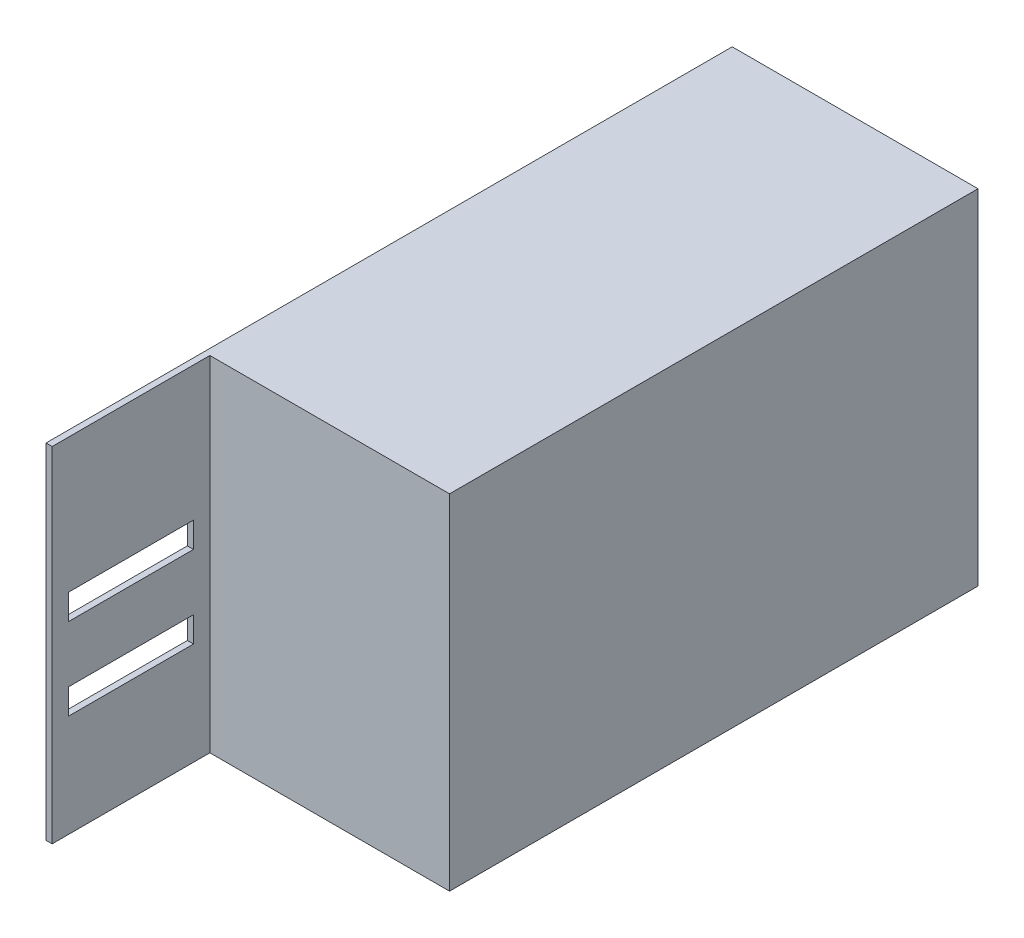
from build123d import *

# Parameters (mm, degrees)
SKETCH1_W           = 84
SKETCH1_H           = 129
BOSS_EXTRUDE1_DEPTH = 60
SHELL1_T            = -1.5
CUT_EXTRUDE1_DEPTH  = 127.5
SKETCH3_W           = 40
SKETCH3_H           = 84
BOSS_EXTRUDE2_DEPTH = 1.5
SKETCH4_W           = 30.5
SKETCH4_H           = 6.2
CUT_EXTRUDE2_DEPTH  = 165.679233664


with BuildPart() as part:
    # Sketch1 → Boss-Extrude1 (new body)
    with BuildSketch(Plane.YZ):
        with Locations((42, -64.5)):
            Rectangle(SKETCH1_W, SKETCH1_H)
    extrude(amount=BOSS_EXTRUDE1_DEPTH)

    # Shell1
    shell1_openings = [part.faces().sort_by_distance(p)[0] for p in [
        (0, 42, -64.5),
    ]]
    offset(amount=SHELL1_T, openings=shell1_openings, kind=Kind.INTERSECTION)

    # Sketch2 → Cut-Extrude1 (cut)
    with BuildSketch(Plane(origin=(0, 0, -129), x_dir=(1, 0, 0), z_dir=(0, 0, -1))):
        Polygon((1.5, -82.5), (58.5, -82.5), (58.5, -1.5), (1.5, -1.5), (0, -1.5), (0, -82.5), align=None)
    extrude(amount=-CUT_EXTRUDE1_DEPTH, mode=Mode.SUBTRACT)

    # Sketch3 → Boss-Extrude2 (add)
    with BuildSketch(Plane.ZY):
        with Locations((18.5, 42)):
            Rectangle(SKETCH3_W, SKETCH3_H)
    extrude(amount=-BOSS_EXTRUDE2_DEPTH)

    # Sketch4 → Cut-Extrude2 (cut, through all)
    with BuildSketch(Plane(origin=(1.5, 0, 0), x_dir=(0, 0, -1), z_dir=(1, 0, 0))):
        with Locations((-19.25, 28.1)):
            Rectangle(SKETCH4_W, SKETCH4_H)
        with Locations((-19.25, 48.1)):
            Rectangle(SKETCH4_W, SKETCH4_H)
    extrude(amount=-CUT_EXTRUDE2_DEPTH, mode=Mode.SUBTRACT)


solid = part.part
